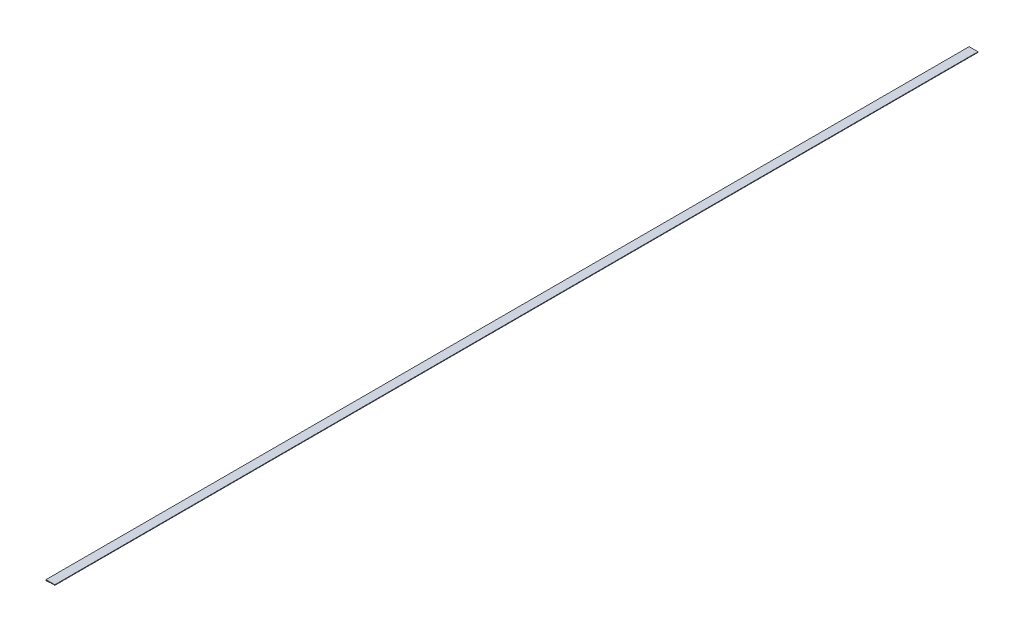
from build123d import *

# Parameters (mm, degrees)
BOSS_EXTRUDE1_DEPTH = 5214.4


with BuildPart() as part:
    # Sketch2 → Boss-Extrude1 (new body)
    with BuildSketch(Plane.XY):
        Polygon((-7.619424107, 25.4), (-32.619424107, 23.212783412), (-32.619424107, 28.575), (17.380575893, 28.575), (17.380575893, 25.4), align=None)
    extrude(amount=-BOSS_EXTRUDE1_DEPTH)


solid = part.part
